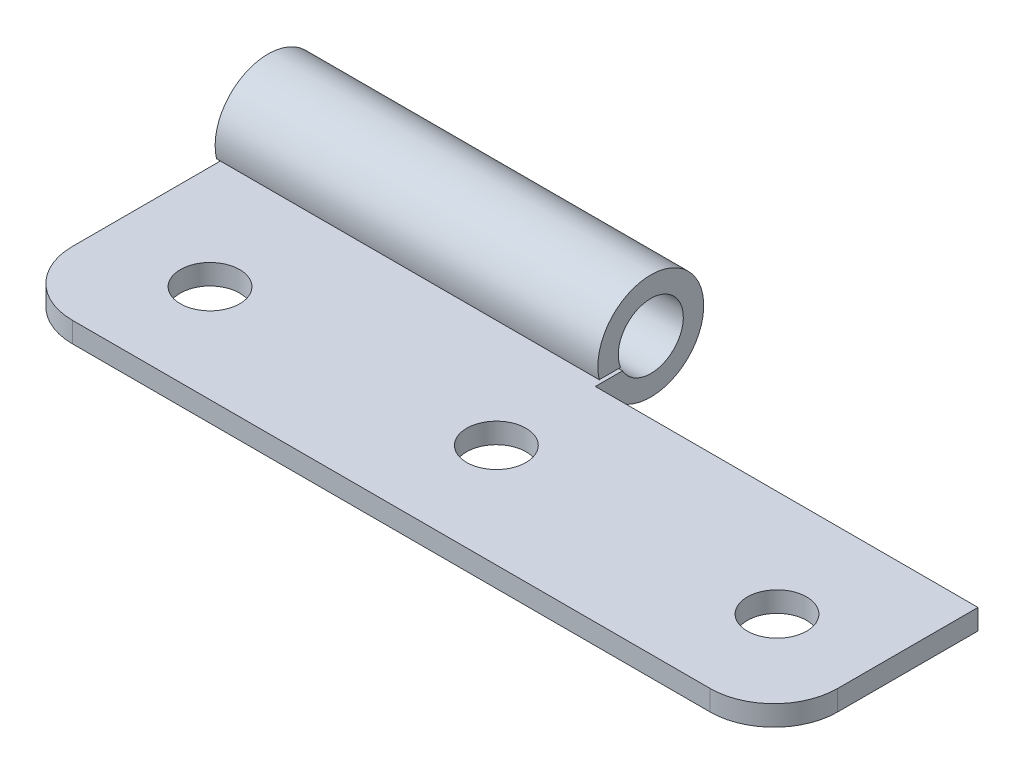
from build123d import *

# Parameters (mm, degrees)
SKETCH_1_R               = 4.15
EXTRUDE_1_DEPTH          = 60
SKETCH_2_R               = 2.325
EXTRUDE_2_DEPTH          = 1.6
FILLET_1_R               = 5
CUT_EXTRUDE_2_DEPTH      = 64.492873616
CUT_EXTRUDE_1_DEPTH      = 64.586810739
CUT_EXTRUDE_1_DEPTH_BACK = 64.586810739
SKETCH_4_W               = 30
SKETCH_4_H               = 8.5


with BuildPart() as part:
    # Эскиз1 → Бобышка-Вытянуть1 (new body)
    with BuildSketch(Plane(origin=(0, 0, 0), x_dir=(0, 0, -1), z_dir=(1, 0, 0))):
        Circle(SKETCH_1_R)
    extrude(amount=EXTRUDE_1_DEPTH)

    # Эскиз2 → Бобышка-Вытянуть2 (add)
    with BuildSketch(Plane(origin=(0, -2.85, 0), x_dir=(1, 0, 0), z_dir=(0, 1, 0))):
        Polygon((0, -4.15), (0, -20.35), (60, -20.35), (60, -4.15), (60, 0), (0, 0), align=None)
        with Locations(Location((8.125, -12.675, 0), (0, 0, 270))):
            Circle(SKETCH_2_R, mode=Mode.SUBTRACT)
        with Locations(Location((30.119163283, -12.225, 0), (0, 0, 270))):
            Circle(SKETCH_2_R, mode=Mode.SUBTRACT)
        with Locations(Location((52.569163283, -12.675, 0), (0, 0, 270))):
            Circle(SKETCH_2_R, mode=Mode.SUBTRACT)
    extrude(amount=EXTRUDE_2_DEPTH)

    # Скругление1
    fillet_1_edges = [part.edges().sort_by_distance(p)[0] for p in [
        (0, -2.05, 20.35),
        (60, -2.05, 20.35),
    ]]
    fillet(fillet_1_edges, radius=FILLET_1_R)

    # Эскиз5 → Вырез-Вытянуть2 (cut, through all)
    with BuildSketch(Plane.ZY):
        with BuildLine():
            Line((3.957271787, -1.25), (2.222611077, -1.25))
            ThreePointArc((2.222611077, -1.25), (-2.299419251, 1.102347998), (2.366431913, -0.95))
            Line((2.366431913, -0.95), (4.039801975, -0.95))
            Line((4.039801975, -0.95), (4.039801975, -1.25))
            Line((4.039801975, -1.25), (3.957271787, -1.25))
        make_face()
    extrude(amount=-CUT_EXTRUDE_2_DEPTH, mode=Mode.SUBTRACT)

    # Эскиз4 → Вырез-Вытянуть1 (cut, two sides: drawn at the far end of the back side and taken through both)
    with BuildSketch(Plane(origin=(0, -1.25, 0), x_dir=(1, 0, 0), z_dir=(0, 1, 0)).offset(-CUT_EXTRUDE_1_DEPTH_BACK)):
        with Locations((45, -0.1)):
            Rectangle(SKETCH_4_W, SKETCH_4_H)
    extrude(amount=CUT_EXTRUDE_1_DEPTH + CUT_EXTRUDE_1_DEPTH_BACK, mode=Mode.SUBTRACT)


solid = part.part
